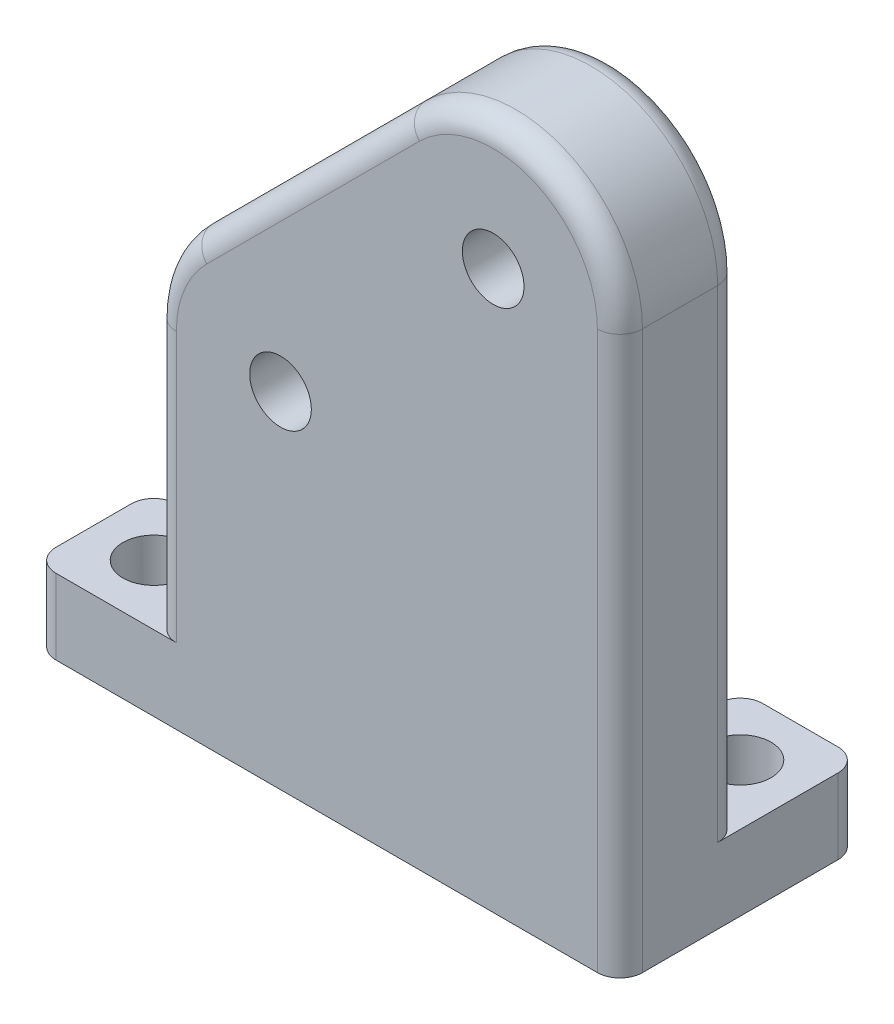
from build123d import *

# Parameters (mm, degrees)
ESQUISSE7_R             = 2.05
BOSS_EXTRU_1_DEPTH      = 8
ESQUISSE11_W            = 8
ESQUISSE11_H            = 5
BOSS_EXTRU_4_DEPTH      = 8
ESQUISSE12_R            = 2.05
ENL_V_MAT_EXTRU_1_DEPTH = 10
CONG_1_R                = 1.5


with BuildPart() as part:
    # Esquisse7 → Boss.-Extru.1 (new body)
    with BuildSketch(Plane.XY):
        with BuildLine():
            Line((0, 0), (39, 0))
            Line((39, 0), (39, 37.071067812))
            ThreePointArc((39, 37.071067812), (33.796680513, 44.858385741), (24.610912703, 43.03122292))
            Line((24.610912703, 43.03122292), (10.46877708, 28.889087297))
            ThreePointArc((10.46877708, 28.889087297), (8.641614259, 26.154544889), (8, 22.928932188))
            Line((8, 22.928932188), (8, 5))
            Line((8, 5), (0, 5))
            Line((0, 5), (0, 0))
        make_face()
        with Locations((16.428932188, 22.928932188)):
            Circle(ESQUISSE7_R, mode=Mode.SUBTRACT)
        with Locations(Location((30.571067812, 37.071067812, 0), (0, 0, 180))):
            Circle(ESQUISSE7_R, mode=Mode.SUBTRACT)
    extrude(amount=BOSS_EXTRU_1_DEPTH)

    # Esquisse11 → Boss.-Extru.4 (add)
    with BuildSketch(Plane(origin=(0, 0, 0), x_dir=(-1, 0, 0), z_dir=(0, 0, -1))):
        with Locations((-35, 2.5)):
            Rectangle(ESQUISSE11_W, ESQUISSE11_H)
    extrude(amount=BOSS_EXTRU_4_DEPTH)

    # Esquisse12 → Enlèv. mat.-Extru.1 (cut)
    with BuildSketch(Plane(origin=(0, 5, 0), x_dir=(1, 0, 0), z_dir=(0, 1, 0))):
        with Locations(Location((4, -4, 0), (0, 0, 180))):
            Circle(ESQUISSE12_R)
        with Locations(Location((35, 4, 0), (0, 0, 180))):
            Circle(ESQUISSE12_R)
    extrude(amount=-ENL_V_MAT_EXTRU_1_DEPTH, mode=Mode.SUBTRACT)

    # Congé1
    cong_1_edges = [part.edges().sort_by_distance(p)[0] for p in [
        (0, 2.5, 8),
        (0, 2.5, 0),
        (31, 2.5, -8),
        (39, 2.5, -8),
        (39, 21.035533906, 0),
        (39, 18.535533906, 8),
        (33.796680513, 44.858385741, 0),
        (33.796680513, 44.858385741, 8),
        (17.539844892, 35.960155108, 8),
        (17.539844892, 35.960155108, 0),
        (8, 13.964466094, 0),
        (8, 13.964466094, 8),
    ]]
    fillet(cong_1_edges, radius=CONG_1_R)


solid = part.part
